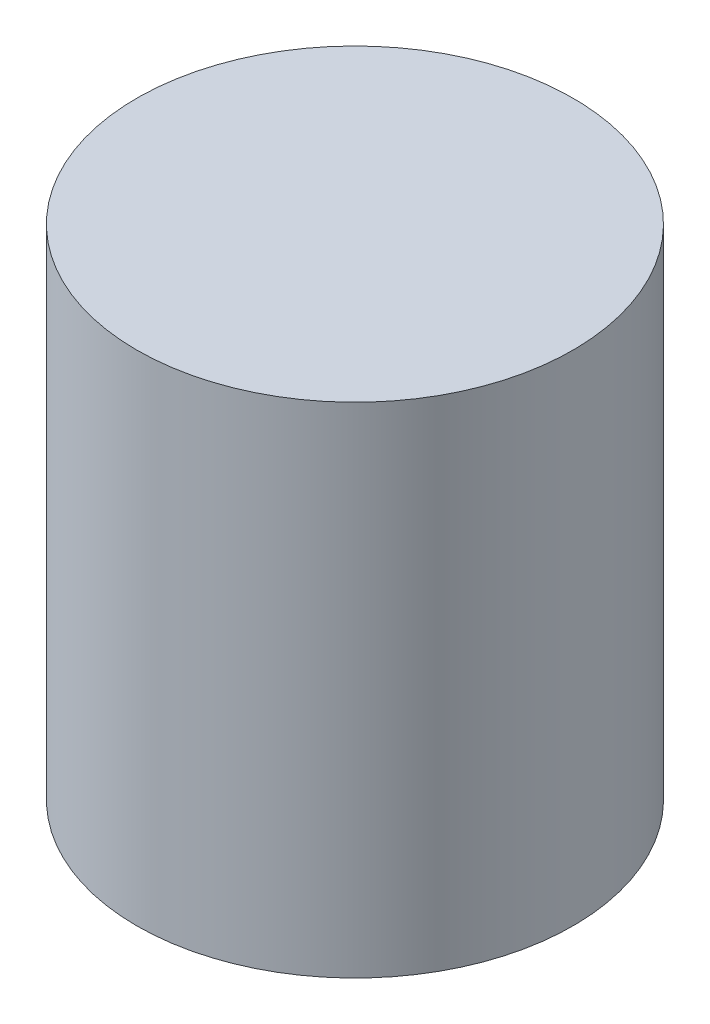
from build123d import *

# Parameters (mm, degrees)
SKETCH1_R           = 1.75
BOSS_EXTRUDE1_DEPTH = 4


with BuildPart() as part:
    # Sketch1 → Boss-Extrude1 (new body)
    with BuildSketch(Plane(origin=(0, 0, 0), x_dir=(1, 0, 0), z_dir=(0, 1, 0))):
        with Locations(Location((-2.447915396, -0.958023949, 0), (0, 0, 270))):
            Circle(SKETCH1_R)
    extrude(amount=BOSS_EXTRUDE1_DEPTH)


solid = part.part
